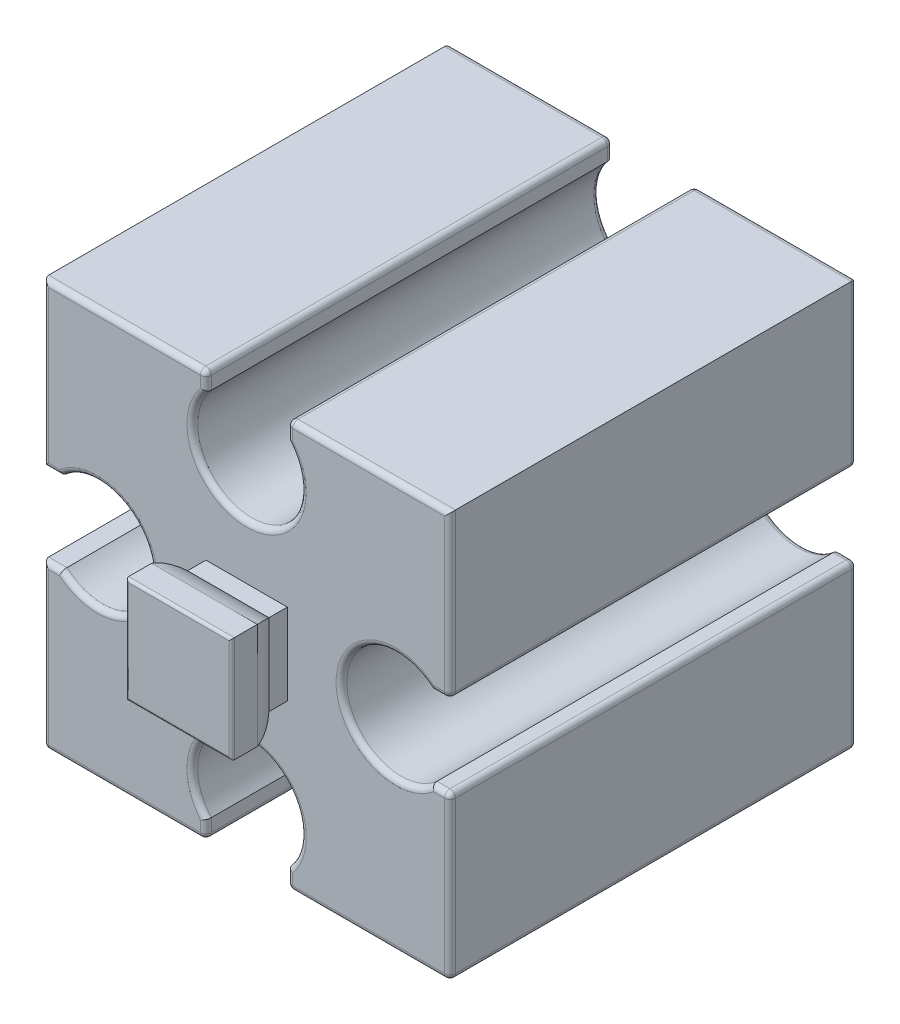
from build123d import *

# Parameters (mm, degrees)
SKETCH_1_W                      = 15
SKETCH_1_H                      = 15
EXTRUDE_1_DEPTH                 = 15
EXTRUDE_2_DEPTH                 = 1.5
EXTRUDE_2_DEPTH_BACK            = 1.5
SKETCH_2_W                      = 3
SKETCH_2_H                      = 1
EXTRUDE_3_DEPTH                 = 3
EXTRUDE_3_DEPTH_BACK            = 3
CUT_EXTRUDE_2_DEPTH             = 19.371173071
CUT_EXTRUDE_7_REACH             = 20.371
CUT_EXTRUDE_7_DIRECTION_2_REACH = 20.371
SKETCH_13_W                     = 3
SKETCH_13_H                     = 3
EXTRUDE_4_DEPTH                 = 1
EXTRUDE_5_DEPTH                 = 2
EXTRUDE_5_DEPTH_BACK            = 2
CUT_EXTRUDE_8_REACH             = 22.463
CUT_EXTRUDE_8_DIRECTION_2_REACH = 22.463
FILLET_2_R                      = 0.1
FILLET_3_R                      = 0.2


with BuildPart() as part:
    # 草图1 → 凸台-拉伸1 (new body)
    with BuildSketch(Plane.XY):
        Rectangle(SKETCH_1_W, SKETCH_1_H)
    extrude(amount=-EXTRUDE_1_DEPTH)

    # 草图2 → 凸台-拉伸2 (add, two sides: drawn at the far end of the back side and taken through both)
    with BuildSketch(Plane(origin=(0, 0, 0), x_dir=(1, 0, 0), z_dir=(0, 1, 0)).offset(-EXTRUDE_2_DEPTH_BACK)):
        with Locations((0, -0.5)):
            Rectangle(SKETCH_2_W, SKETCH_2_H)
    extrude(amount=EXTRUDE_2_DEPTH + EXTRUDE_2_DEPTH_BACK)

    # 草图3 → 凸台-拉伸3 (add, two sides: drawn at the far end of the back side and taken through both)
    with BuildSketch(Plane(origin=(0, 0, 0), x_dir=(1, 0, 0), z_dir=(0, 1, 0)).offset(-EXTRUDE_3_DEPTH_BACK)):
        with BuildLine():
            Line((-1.95, -2.5), (1.95, -2.5))
            Line((1.95, -2.5), (1.95, -1.555590279))
            ThreePointArc((1.95, -1.555590279), (1.780042303, -1.088161527), (1.5, -0.677124344))
            Line((1.5, -0.677124344), (-1.5, -0.677124344))
            ThreePointArc((-1.5, -0.677124344), (-1.780042303, -1.088161527), (-1.95, -1.555590279))
            Line((-1.95, -1.555590279), (-1.95, -2.5))
        make_face()
    extrude(amount=EXTRUDE_3_DEPTH + EXTRUDE_3_DEPTH_BACK)

    # 草图5 → 切除-拉伸2 (cut, through all)
    with BuildSketch(Plane.XY):
        with BuildLine():
            Line((-1.5, -7.5), (1.5, -7.5))
            Line((1.5, -7.5), (1.5, -6.822875656))
            ThreePointArc((1.5, -6.822875656), (0, -3.5), (-1.5, -6.822875656))
            Line((-1.5, -6.822875656), (-1.5, -7.5))
        make_face()
        with BuildLine():
            Line((1.5, 7.5), (1.5, 6.822875656))
            ThreePointArc((1.5, 6.822875656), (0, 3.5), (-1.5, 6.822875656))
            Line((-1.5, 6.822875656), (-1.5, 7.5))
            Line((-1.5, 7.5), (1.5, 7.5))
        make_face()
        with BuildLine():
            Line((-7.5, 1.5), (-6.822875656, 1.5))
            ThreePointArc((-6.822875656, 1.5), (-3.5, 0), (-6.822875656, -1.5))
            Line((-6.822875656, -1.5), (-7.5, -1.5))
            Line((-7.5, -1.5), (-7.5, 1.5))
        make_face()
        with BuildLine():
            Line((7.5, -1.5), (6.822875656, -1.5))
            ThreePointArc((6.822875656, -1.5), (3.5, 0), (6.822875656, 1.5))
            Line((6.822875656, 1.5), (7.5, 1.5))
            Line((7.5, 1.5), (7.5, -1.5))
        make_face()
    extrude(amount=-CUT_EXTRUDE_2_DEPTH, mode=Mode.SUBTRACT)

    # 草图12 → 切除-拉伸7 (cut, up to next)
    with BuildSketch(Plane(origin=(0, 0, 0), x_dir=(0, 0, -1), z_dir=(1, 0, 0)), mode=Mode.PRIVATE) as cut_extrude_7_sk1:
        with BuildLine():
            Line((-2.5, 3), (-2.5, 1.95))
            Line((-2.5, 1.95), (-1.555590279, 1.95))
            ThreePointArc((-1.555590279, 1.95), (-1.088161527, 1.780042303), (-0.677124344, 1.5))
            Line((-0.677124344, 1.5), (-0.677124344, 3))
            Line((-0.677124344, 3), (-2.5, 3))
        make_face()
    cut_extrude_7_tool1 = extrude(cut_extrude_7_sk1.sketch, amount=-CUT_EXTRUDE_7_REACH, mode=Mode.PRIVATE) & part.part
    # 草图12 → 切除-拉伸7 (cut, up to next)
    with BuildSketch(Plane(origin=(0, 0, 0), x_dir=(0, 0, -1), z_dir=(1, 0, 0)), mode=Mode.PRIVATE) as cut_extrude_7_sk2:
        with BuildLine():
            Line((-2.5, -1.95), (-1.555590279, -1.95))
            ThreePointArc((-1.555590279, -1.95), (-1.088161527, -1.780042303), (-0.677124344, -1.5))
            Line((-0.677124344, -1.5), (-0.677124344, -3))
            Line((-0.677124344, -3), (-2.5, -3))
            Line((-2.5, -3), (-2.5, -1.95))
        make_face()
    cut_extrude_7_tool2 = extrude(cut_extrude_7_sk2.sketch, amount=-CUT_EXTRUDE_7_REACH, mode=Mode.PRIVATE) & part.part
    add(cut_extrude_7_tool1.solids().sort_by_distance((0, 2.424924, 1.539049))[0], mode=Mode.SUBTRACT)
    add(cut_extrude_7_tool2.solids().sort_by_distance((0, -2.424924, 1.539049))[0], mode=Mode.SUBTRACT)

    # 草图12 → 切除-拉伸7 direction 2 (cut, up to next)
    with BuildSketch(Plane(origin=(0, 0, 0), x_dir=(0, 0, -1), z_dir=(1, 0, 0)), mode=Mode.PRIVATE) as cut_extrude_7_direction_2_sk1:
        with BuildLine():
            Line((-2.5, 3), (-2.5, 1.95))
            Line((-2.5, 1.95), (-1.555590279, 1.95))
            ThreePointArc((-1.555590279, 1.95), (-1.088161527, 1.780042303), (-0.677124344, 1.5))
            Line((-0.677124344, 1.5), (-0.677124344, 3))
            Line((-0.677124344, 3), (-2.5, 3))
        make_face()
    cut_extrude_7_direction_2_tool1 = extrude(cut_extrude_7_direction_2_sk1.sketch, amount=CUT_EXTRUDE_7_DIRECTION_2_REACH, mode=Mode.PRIVATE) & part.part
    # 草图12 → 切除-拉伸7 direction 2 (cut, up to next)
    with BuildSketch(Plane(origin=(0, 0, 0), x_dir=(0, 0, -1), z_dir=(1, 0, 0)), mode=Mode.PRIVATE) as cut_extrude_7_direction_2_sk2:
        with BuildLine():
            Line((-2.5, -1.95), (-1.555590279, -1.95))
            ThreePointArc((-1.555590279, -1.95), (-1.088161527, -1.780042303), (-0.677124344, -1.5))
            Line((-0.677124344, -1.5), (-0.677124344, -3))
            Line((-0.677124344, -3), (-2.5, -3))
            Line((-2.5, -3), (-2.5, -1.95))
        make_face()
    cut_extrude_7_direction_2_tool2 = extrude(cut_extrude_7_direction_2_sk2.sketch, amount=CUT_EXTRUDE_7_DIRECTION_2_REACH, mode=Mode.PRIVATE) & part.part
    add(cut_extrude_7_direction_2_tool1.solids().sort_by_distance((0, 2.424924, 1.539049))[0], mode=Mode.SUBTRACT)
    add(cut_extrude_7_direction_2_tool2.solids().sort_by_distance((0, -2.424924, 1.539049))[0], mode=Mode.SUBTRACT)

    # 草图13 → 凸台-拉伸4 (add)
    with BuildSketch(Plane(origin=(0, 0, -15), x_dir=(-1, 0, 0), z_dir=(0, 0, -1))):
        Rectangle(SKETCH_13_W, SKETCH_13_H)
    extrude(amount=EXTRUDE_4_DEPTH)

    # 草图14 → 凸台-拉伸5 (add, two sides: drawn at the far end of the back side and taken through both)
    with BuildSketch(Plane(origin=(0, 0, 0), x_dir=(1, 0, 0), z_dir=(0, 1, 0)).offset(-EXTRUDE_5_DEPTH_BACK)):
        with BuildLine():
            Line((-1.95, 17.5), (1.95, 17.5))
            Line((1.95, 17.5), (1.95, 16.555590279))
            ThreePointArc((1.95, 16.555590279), (1.780042303, 16.088161527), (1.5, 15.677124344))
            Line((1.5, 15.677124344), (-1.5, 15.677124344))
            ThreePointArc((-1.5, 15.677124344), (-1.780042303, 16.088161527), (-1.95, 16.555590279))
            Line((-1.95, 16.555590279), (-1.95, 17.5))
        make_face()
    extrude(amount=EXTRUDE_5_DEPTH + EXTRUDE_5_DEPTH_BACK)

    # 草图15 → 切除-拉伸8 (cut, up to next)
    with BuildSketch(Plane(origin=(0, 0, 0), x_dir=(0, 0, -1), z_dir=(1, 0, 0)), mode=Mode.PRIVATE) as cut_extrude_8_sk1:
        with BuildLine():
            Line((17.5, 2), (17.5, 1.95))
            Line((17.5, 1.95), (16.555590279, 1.95))
            ThreePointArc((16.555590279, 1.95), (16.088161527, 1.780042303), (15.677124344, 1.5))
            Line((15.677124344, 1.5), (15.677124344, 2))
            Line((15.677124344, 2), (17.5, 2))
        make_face()
    cut_extrude_8_tool1 = extrude(cut_extrude_8_sk1.sketch, amount=-CUT_EXTRUDE_8_REACH, mode=Mode.PRIVATE) & part.part
    # 草图15 → 切除-拉伸8 (cut, up to next)
    with BuildSketch(Plane(origin=(0, 0, 0), x_dir=(0, 0, -1), z_dir=(1, 0, 0)), mode=Mode.PRIVATE) as cut_extrude_8_sk2:
        with BuildLine():
            Line((17.5, -2), (15.677124344, -2))
            Line((15.677124344, -2), (15.677124344, -1.5))
            ThreePointArc((15.677124344, -1.5), (16.088161527, -1.780042303), (16.555590279, -1.95))
            Line((16.555590279, -1.95), (17.5, -1.95))
            Line((17.5, -1.95), (17.5, -2))
        make_face()
    cut_extrude_8_tool2 = extrude(cut_extrude_8_sk2.sketch, amount=-CUT_EXTRUDE_8_REACH, mode=Mode.PRIVATE) & part.part
    add(cut_extrude_8_tool1.solids().sort_by_distance((0, 1.873038, -16.175075))[0], mode=Mode.SUBTRACT)
    add(cut_extrude_8_tool2.solids().sort_by_distance((0, -1.873038, -16.175075))[0], mode=Mode.SUBTRACT)

    # 草图15 → 切除-拉伸8 direction 2 (cut, up to next)
    with BuildSketch(Plane(origin=(0, 0, 0), x_dir=(0, 0, -1), z_dir=(1, 0, 0)), mode=Mode.PRIVATE) as cut_extrude_8_direction_2_sk1:
        with BuildLine():
            Line((17.5, 2), (17.5, 1.95))
            Line((17.5, 1.95), (16.555590279, 1.95))
            ThreePointArc((16.555590279, 1.95), (16.088161527, 1.780042303), (15.677124344, 1.5))
            Line((15.677124344, 1.5), (15.677124344, 2))
            Line((15.677124344, 2), (17.5, 2))
        make_face()
    cut_extrude_8_direction_2_tool1 = extrude(cut_extrude_8_direction_2_sk1.sketch, amount=CUT_EXTRUDE_8_DIRECTION_2_REACH, mode=Mode.PRIVATE) & part.part
    # 草图15 → 切除-拉伸8 direction 2 (cut, up to next)
    with BuildSketch(Plane(origin=(0, 0, 0), x_dir=(0, 0, -1), z_dir=(1, 0, 0)), mode=Mode.PRIVATE) as cut_extrude_8_direction_2_sk2:
        with BuildLine():
            Line((17.5, -2), (15.677124344, -2))
            Line((15.677124344, -2), (15.677124344, -1.5))
            ThreePointArc((15.677124344, -1.5), (16.088161527, -1.780042303), (16.555590279, -1.95))
            Line((16.555590279, -1.95), (17.5, -1.95))
            Line((17.5, -1.95), (17.5, -2))
        make_face()
    cut_extrude_8_direction_2_tool2 = extrude(cut_extrude_8_direction_2_sk2.sketch, amount=CUT_EXTRUDE_8_DIRECTION_2_REACH, mode=Mode.PRIVATE) & part.part
    add(cut_extrude_8_direction_2_tool1.solids().sort_by_distance((0, 1.873038, -16.175075))[0], mode=Mode.SUBTRACT)
    add(cut_extrude_8_direction_2_tool2.solids().sort_by_distance((0, -1.873038, -16.175075))[0], mode=Mode.SUBTRACT)

    # 圆角2
    fillet_2_edges = [part.edges().sort_by_distance(p)[0] for p in [
        (0, 1.95, 2.5),
        (-1.95, 0, 2.5),
        (1.95, 0, 2.5),
        (0, -1.95, 2.5),
        (1.95, 0, -17.5),
        (-1.95, 0, -17.5),
        (0, -1.95, -17.5),
        (0, 1.95, -17.5),
    ]]
    fillet(fillet_2_edges, radius=FILLET_2_R)

    # 圆角3
    fillet_3_edges = [part.edges().sort_by_distance(p)[0] for p in [
        (7.5, -4.5, -15),
        (4.5, 7.5, -15),
        (-7.5, 4.5, -15),
        (4.5, 7.5, 0),
        (4.5, -7.5, -15),
        (4.5, -7.5, 0),
        (7.5, -4.5, 0),
        (0, -3.5, -15),
        (1.5, -7.161437828, -15),
        (1.5, -7.5, -7.5),
        (-1.5, -7.161437828, -15),
        (-1.5, -7.5, -7.5),
        (0, -3.5, 0),
        (-4.5, -7.5, 0),
        (-1.5, -7.161437828, 0),
        (1.5, -7.161437828, 0),
        (-7.5, 4.5, 0),
        (-7.5, -4.5, -15),
        (-7.5, -4.5, 0),
        (-3.5, 0, -15),
        (-7.161437828, -1.5, -15),
        (-7.161437828, 1.5, -15),
        (-3.5, 0, 0),
        (-7.161437828, 1.5, 0),
        (-7.161437828, -1.5, 0),
        (-4.5, -7.5, -15),
        (-4.5, 7.5, -15),
        (-4.5, 7.5, 0),
        (7.5, -7.5, -7.5),
        (-7.5, -7.5, -7.5),
        (0, 3.5, -15),
        (-1.5, 7.161437828, -15),
        (-1.5, 7.5, -7.5),
        (1.5, 7.161437828, -15),
        (1.5, 7.5, -7.5),
        (0, 3.5, 0),
        (1.5, 7.161437828, 0),
        (-1.5, 7.161437828, 0),
        (7.5, 4.5, -15),
        (7.5, 4.5, 0),
        (3.5, 0, -15),
        (7.161437828, 1.5, -15),
        (7.5, 1.5, -7.5),
        (7.161437828, -1.5, -15),
        (7.5, -1.5, -7.5),
        (3.5, 0, 0),
        (7.161437828, -1.5, 0),
        (7.161437828, 1.5, 0),
    ]]
    fillet(fillet_3_edges, radius=FILLET_3_R)


solid = part.part
